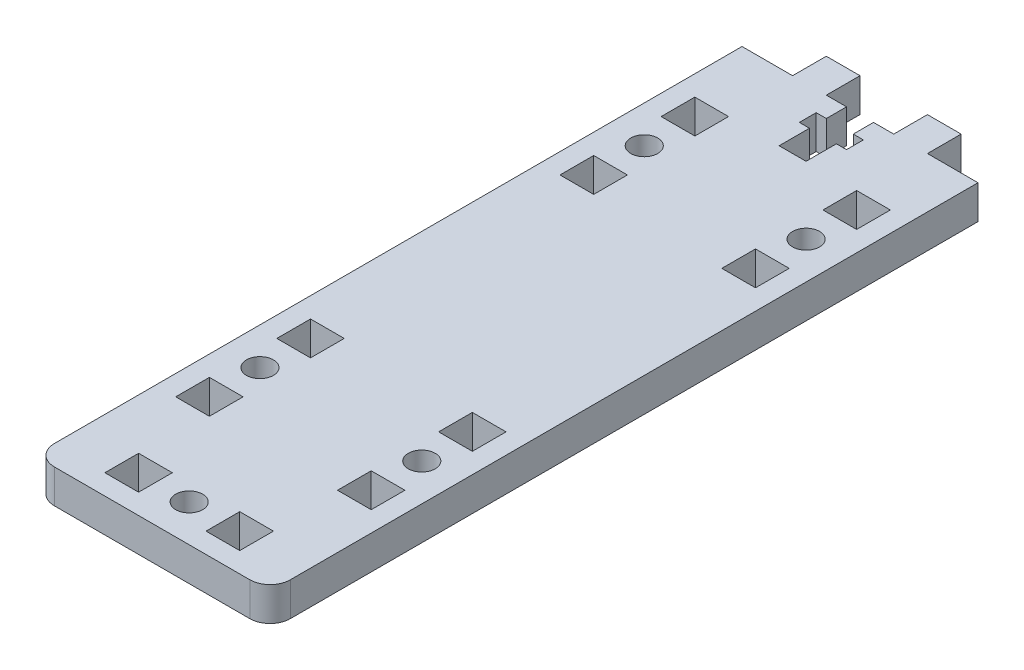
from build123d import *

# Parameters (mm, degrees)
SKETCH1_R           = 2
SKETCH1_W           = 5
SKETCH1_H           = 5
BOSS_EXTRUDE7_DEPTH = 5
FILLET2_R           = 3


with BuildPart() as part:
    # Sketch1 → Boss-Extrude7 (new body)
    with BuildSketch(Plane(origin=(0, 0, 0), x_dir=(1, 0, 0), z_dir=(0, 1, 0))):
        Polygon((-29.056186132, 30.501621615), (-21.556186132, 30.501621615), (-21.556186132, 35.501621615), (-16.556186132, 35.501621615), (-16.556186132, 30.501621615), (-13.556186132, 30.501621615), (-13.556186132, 27.501621615), (-15.056186132, 27.501621615), (-15.056186132, 25.001621615), (-13.556186132, 25.001621615), (-13.556186132, 20.501621615), (-9.556186132, 20.501621615), (-9.556186132, 25.001621615), (-8.056186132, 25.001621615), (-8.056186132, 27.501621615), (-9.556186132, 27.501621615), (-9.556186132, 30.501621615), (-6.556186132, 30.501621615), (-6.556186132, 35.501621615), (-1.556186132, 35.501621615), (-1.556186132, 30.501621615), (5.943813868, 30.501621615), (5.943813868, -74.498378385), (-29.056186132, -74.498378385), align=None)
        with Locations(Location((0.443813868, 10.501621615, 0), (0, 0, 270))):
            Circle(SKETCH1_R, mode=Mode.SUBTRACT)
        with Locations(Location((-23.556186132, 10.501621615, 0), (0, 0, 90))):
            Circle(SKETCH1_R, mode=Mode.SUBTRACT)
        with Locations(Location((0.443813868, -46.498378385, 0), (0, 0, 90))):
            Circle(SKETCH1_R, mode=Mode.SUBTRACT)
        with Locations(Location((-23.556186132, -46.498378385, 0), (0, 0, 270))):
            Circle(SKETCH1_R, mode=Mode.SUBTRACT)
        with Locations(Location((-11.556186132, -68.998378385, 0), (0, 0, 270))):
            Circle(SKETCH1_R, mode=Mode.SUBTRACT)
        with Locations((-23.556186132, 3.001621615)):
            Rectangle(SKETCH1_W, SKETCH1_H, mode=Mode.SUBTRACT)
        with Locations((-23.556186132, 18.001621615)):
            Rectangle(SKETCH1_W, SKETCH1_H, mode=Mode.SUBTRACT)
        with Locations((0.443813868, 3.001621615)):
            Rectangle(SKETCH1_W, SKETCH1_H, mode=Mode.SUBTRACT)
        with Locations((0.443813868, 18.001621615)):
            Rectangle(SKETCH1_W, SKETCH1_H, mode=Mode.SUBTRACT)
        with Locations((0.443813868, -38.998378385)):
            Rectangle(SKETCH1_W, SKETCH1_H, mode=Mode.SUBTRACT)
        with Locations((0.443813868, -53.998378385)):
            Rectangle(SKETCH1_W, SKETCH1_H, mode=Mode.SUBTRACT)
        with Locations((-23.556186132, -53.998378385)):
            Rectangle(SKETCH1_W, SKETCH1_H, mode=Mode.SUBTRACT)
        with Locations((-23.556186132, -38.998378385)):
            Rectangle(SKETCH1_W, SKETCH1_H, mode=Mode.SUBTRACT)
        with Locations((-19.056186132, -68.998378385)):
            Rectangle(SKETCH1_W, SKETCH1_H, mode=Mode.SUBTRACT)
        with Locations((-4.056186132, -68.998378385)):
            Rectangle(SKETCH1_W, SKETCH1_H, mode=Mode.SUBTRACT)
    extrude(amount=BOSS_EXTRUDE7_DEPTH)

    # Fillet2
    fillet2_edges = [part.edges().sort_by_distance(p)[0] for p in [
        (5.943813868, 2.5, 74.498378385),
        (-29.056186132, 2.5, 74.498378385),
    ]]
    fillet(fillet2_edges, radius=FILLET2_R)


solid = part.part
